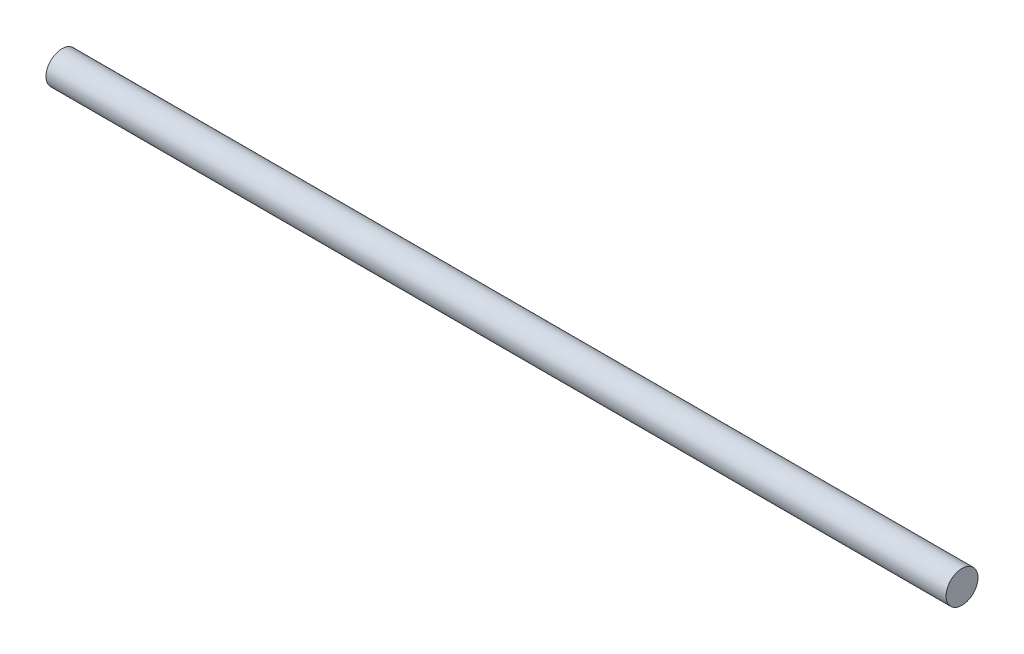
from build123d import *

# Parameters (mm, degrees)
SKETCH1_R           = 0.1775
BOSS_EXTRUDE1_DEPTH = 5


with BuildPart() as part:
    # Sketch1 → Boss-Extrude1 (new, symmetric)
    with BuildSketch(Plane(origin=(0, 0, 0), x_dir=(0, 0, -1), z_dir=(1, 0, 0))):
        Circle(SKETCH1_R)
    extrude(amount=BOSS_EXTRUDE1_DEPTH, both=True)


solid = part.part
